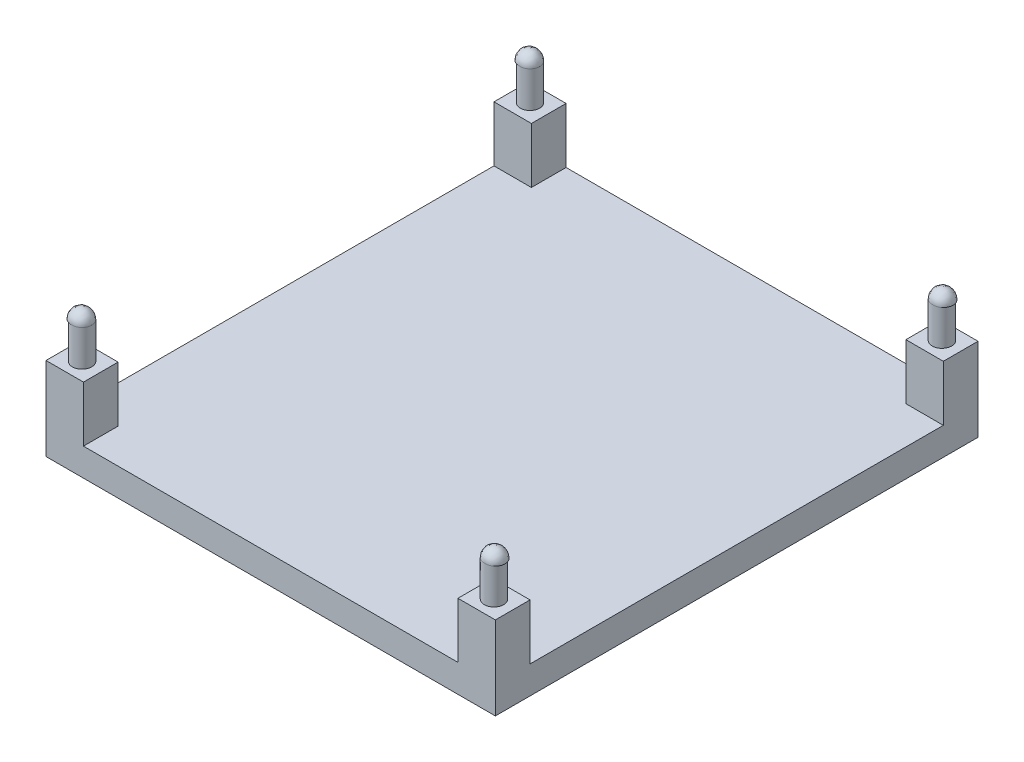
from build123d import *

# Parameters (mm, degrees)
SKETCH2_R             = 1.778
BOSS_EXTRUDE2_DEPTH   = 21.844
BOSS_EXTRUDE2_2_DEPTH = 21.844
BOSS_EXTRUDE2_3_DEPTH = 21.844
BOSS_EXTRUDE2_4_DEPTH = 21.844
SKETCH2_4_W           = 82.296
SKETCH2_4_H           = 88.392
BOSS_EXTRUDE3_DEPTH   = 5.08
REVOLVE1_ANGLE        = 180
LPATTERN1_COUNT       = 2
LPATTERN1_PITCH       = 75.692
LPATTERN1_COUNT_DIR2  = 2
LPATTERN1_PITCH_DIR2  = 82.042
SKETCH5_W             = 6.858
SKETCH5_H             = 6.35
BOSS_EXTRUDE4_DEPTH   = 10.16


with BuildPart() as part:
    # Sketch2 → Boss-Extrude2 (new body)
    with BuildSketch(Plane(origin=(0, 0, 0), x_dir=(1, 0, 0), z_dir=(0, 1, 0))):
        with Locations((37.719, -41.021)):
            Circle(SKETCH2_R)
    extrude(amount=BOSS_EXTRUDE2_DEPTH)



with BuildPart() as body_2:
    # Sketch2 → Boss-Extrude2 2 (new body)
    with BuildSketch(Plane(origin=(0, 0, 0), x_dir=(1, 0, 0), z_dir=(0, 1, 0))):
        with Locations((-37.719, -41.021)):
            Circle(SKETCH2_R)
    extrude(amount=BOSS_EXTRUDE2_2_DEPTH)


with BuildPart() as body_3:
    # Sketch2 → Boss-Extrude2 3 (new body)
    with BuildSketch(Plane(origin=(0, 0, 0), x_dir=(1, 0, 0), z_dir=(0, 1, 0))):
        with Locations((37.719, 41.021)):
            Circle(SKETCH2_R)
    extrude(amount=BOSS_EXTRUDE2_3_DEPTH)


with BuildPart() as body_4:
    # Sketch2 → Boss-Extrude2 4 (new body)
    with BuildSketch(Plane(origin=(0, 0, 0), x_dir=(1, 0, 0), z_dir=(0, 1, 0))):
        with Locations((-37.719, 41.021)):
            Circle(SKETCH2_R)
    extrude(amount=BOSS_EXTRUDE2_4_DEPTH)


with BuildPart() as part_1:
    add(part.part)

    add(body_2.part)  # Boss-Extrude3 merges body 2

    add(body_3.part)  # Boss-Extrude3 merges body 3

    add(body_4.part)  # Boss-Extrude3 merges body 4
    # Sketch2<4> → Boss-Extrude3 (add)
    with BuildSketch(Plane(origin=(0, 0, 0), x_dir=(1, 0, 0), z_dir=(0, 1, 0))):
        Rectangle(SKETCH2_4_W, SKETCH2_4_H)
    extrude(amount=BOSS_EXTRUDE3_DEPTH)

    # Sketch3 → Revolve1 (revolve)
    with BuildSketch(Plane(origin=(0, 21.844, 0), x_dir=(1, 0, 0), z_dir=(0, 1, 0))):
        with BuildLine():
            Line((37.845677255, -39.247518432), (37.845677255, -42.794481568))
            ThreePointArc((37.845677255, -42.794481568), (39.75035451, -41.021), (37.845677255, -39.247518432))
        make_face()
    revolve1 = revolve(axis=Axis((37.845677255, 21.844, 39.247518432), (0, 0, 1)), revolution_arc=REVOLVE1_ANGLE)

    # LPattern1: Revolve1 2 × 2
    with Locations(*[(-i * LPATTERN1_PITCH, 0, -j * LPATTERN1_PITCH_DIR2) for i in range(LPATTERN1_COUNT) for j in range(LPATTERN1_COUNT_DIR2) if (i, j) != (0, 0)]):
        add(revolve1)

    # Sketch5 → Boss-Extrude4 (add)
    with BuildSketch(Plane(origin=(0, 5.08, 0), x_dir=(1, 0, 0), z_dir=(0, 1, 0))):
        with Locations((-37.719, 41.021)):
            Rectangle(SKETCH5_W, SKETCH5_H)
        with Locations((37.719, -41.021)):
            Rectangle(SKETCH5_W, SKETCH5_H)
        with Locations((-37.719, -41.021)):
            Rectangle(SKETCH5_W, SKETCH5_H)
        with Locations((37.719, 41.021)):
            Rectangle(SKETCH5_W, SKETCH5_H)
    extrude(amount=BOSS_EXTRUDE4_DEPTH)


solid = part_1.part
